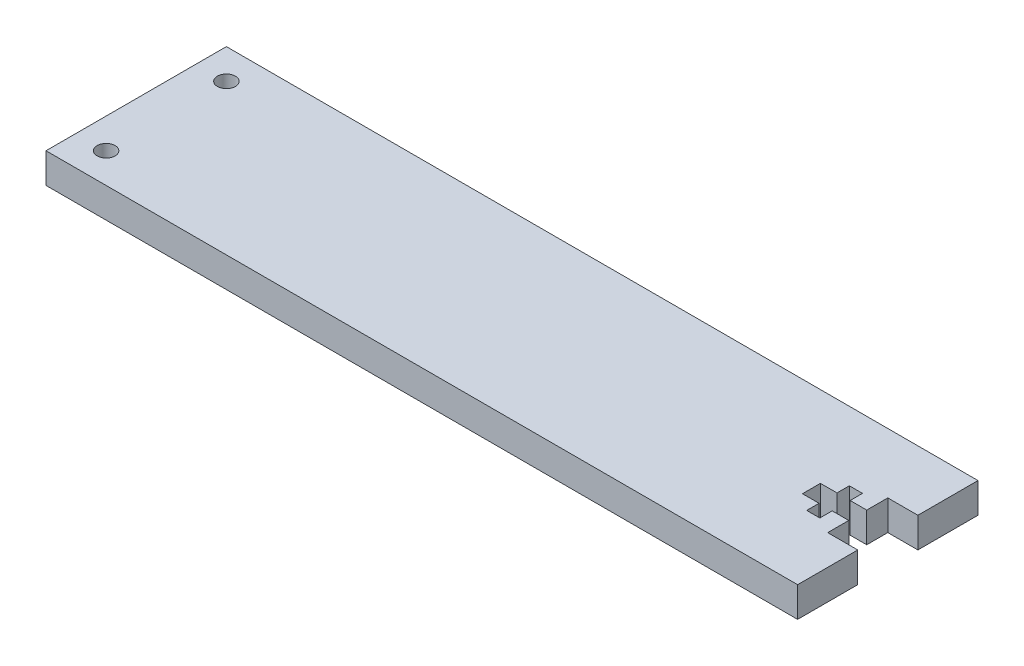
from build123d import *

# Parameters (mm, degrees)
SKETCH1_W             = 158.75
SKETCH1_H             = 38.1
BOSS_EXTRUDE1_DEPTH   = 3.175
CUT_EXTRUDE1_REACH    = 83.876
F_6_CLEARANCE_HOLE1_D = 3.7973


with BuildPart() as part:
    # Sketch1 → Boss-Extrude1 (new, symmetric)
    with BuildSketch(Plane(origin=(0, 0, 0), x_dir=(1, 0, 0), z_dir=(0, 1, 0))):
        Rectangle(SKETCH1_W, SKETCH1_H)
    extrude(amount=BOSS_EXTRUDE1_DEPTH, both=True)

    # Sketch2 → Cut-Extrude1 (cut, up to next)
    with BuildSketch(Plane(origin=(0, 3.175, 0), x_dir=(1, 0, 0), z_dir=(0, 1, 0)), mode=Mode.PRIVATE) as cut_extrude1_sk1:
        Polygon((79.375, -6.35), (79.375, 6.35), (73.025, 6.35), (73.025, 1.89865), (69.524626, 1.89865), (69.524626, 4.504546622), (66.746374, 4.504546622), (66.746374, 1.89865), (63.246, 1.89865), (63.246, -1.89865), (66.746374, -1.89865), (66.746374, -4.504546622), (69.524626, -4.504546622), (69.524626, -1.89865), (73.025, -1.89865), (73.025, -6.35), align=None)
    cut_extrude1_tool1 = extrude(cut_extrude1_sk1.sketch, amount=-CUT_EXTRUDE1_REACH, mode=Mode.PRIVATE) & part.part
    add(cut_extrude1_tool1.solids().sort_by_distance((73.052853, 3.175, 0))[0], mode=Mode.SUBTRACT)

    # #6 Clearance Hole1 (through all)
    with Locations(Plane(origin=(0, 3.175, 0), x_dir=(1, 0, 0), z_dir=(0, 1, 0))):
        with Locations((-73.025, -12.7)):
            f_6_clearance_hole1 = Hole(F_6_CLEARANCE_HOLE1_D / 2)

    # Mirror1: #6 Clearance Hole1 across plane
    add(f_6_clearance_hole1.mirror(Plane.XY), mode=Mode.SUBTRACT)


solid = part.part
